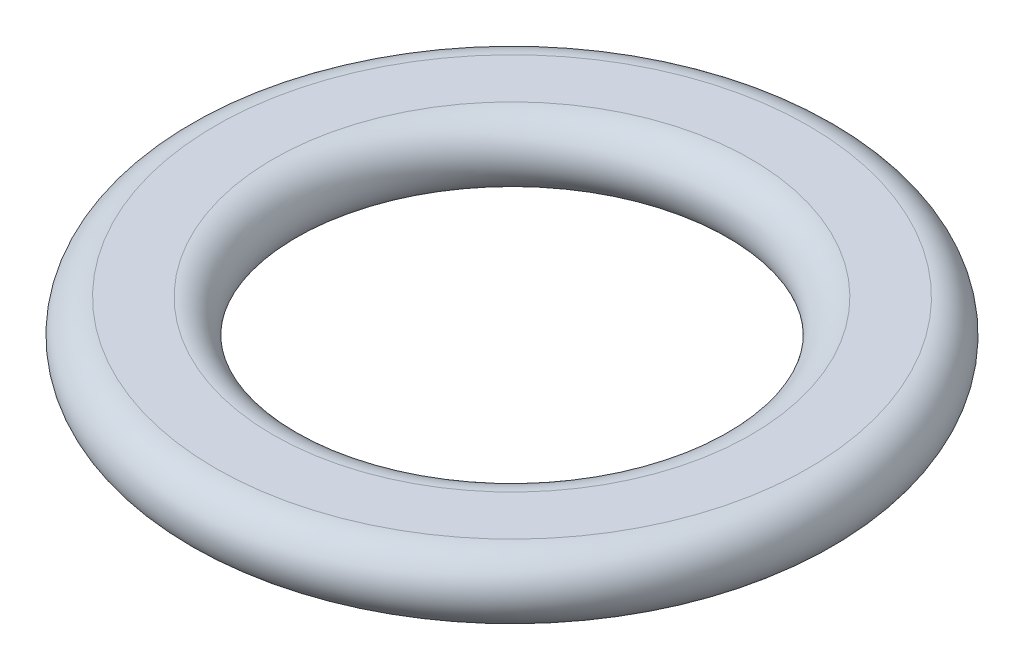
from build123d import *


with BuildPart() as part:
    # ProfileS → Profile (revolve)
    with BuildSketch(Plane.XY):
        with BuildLine():
            Line((2.9, 0.4), (3.6, 0.4))
            ThreePointArc((3.6, 0.4), (4, 0), (3.6, -0.4))
            Line((3.6, -0.4), (2.9, -0.4))
            ThreePointArc((2.9, -0.4), (2.5, 0), (2.9, 0.4))
        make_face()
    revolve(axis=Axis((0, 0.4, 0), (0, -1, 0)))


solid = part.part
